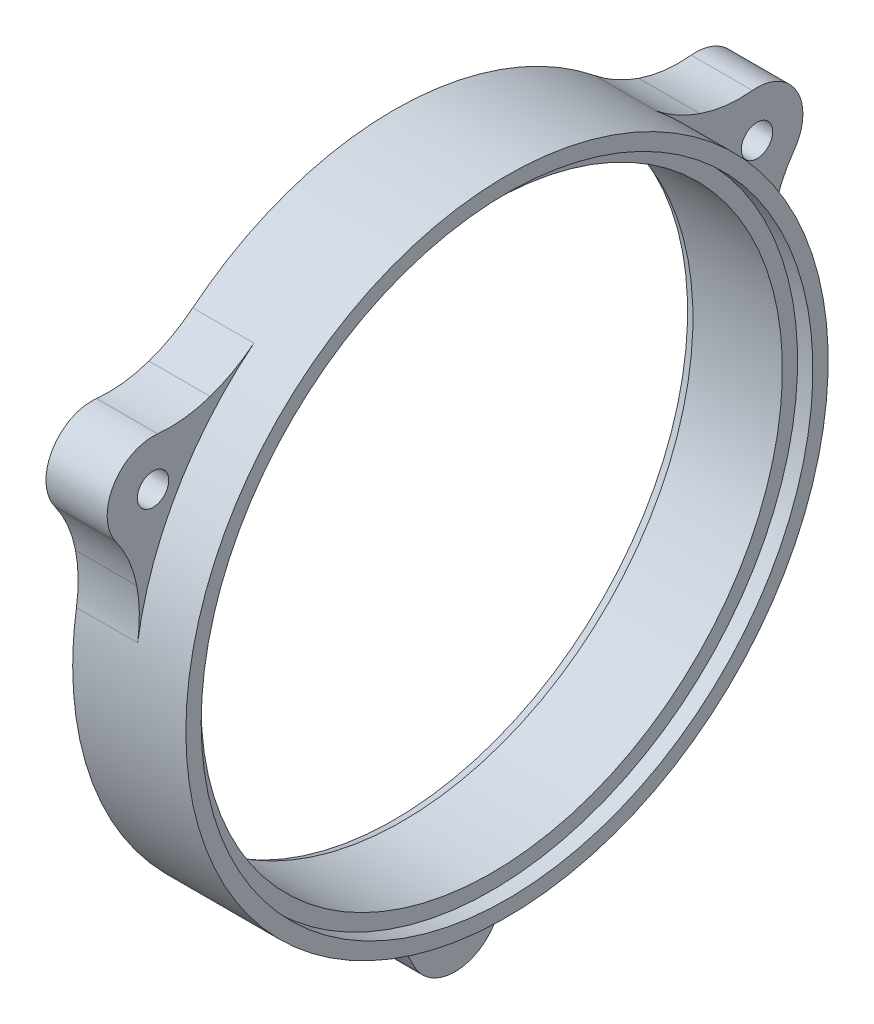
from build123d import *

# Parameters (mm, degrees)
BOSS_EXTRUDE1_START     = -12.7
BOSS_EXTRUDE1_DEPTH     = 12.7
F_1_4_CLEARANCE_HOLE1_D = 6.5278
CIRPATTERN1_COUNT       = 3
CHAMFER1_SIZE           = 0.635
CHAMFER1_SIZE2          = 1.744648161


with BuildPart() as part:
    # Sketch1 → Revolve1 (revolve)
    with BuildSketch(Plane.XY, mode=Mode.PRIVATE) as revolve1_sk:
        Polygon((0, 66.675), (23.495, 66.675), (23.495, 63.5), (20.32, 63.5), (20.32, 60.3504), (0, 60.3504), align=None)
    revolve(revolve1_sk.sketch.rotate(Axis((0, 0, 0), (1, 0, 0)), 90), axis=Axis((0, 0, 0), (1, 0, 0)))

    # Sketch5 → Boss-Extrude1 (add)
    with BuildSketch(Plane.ZY.offset(BOSS_EXTRUDE1_START)):
        with BuildLine():
            ThreePointArc((-61.733643772, 45.671707505), (-70.940470951, 40.9575), (-70.41968082, 30.627050022))
            ThreePointArc((-70.41968082, 30.627050022), (-67.700076965, 25.827577718), (-66.080812198, 20.554138506))
            ThreePointArc((-66.080812198, 20.554138506), (-65.542300069, 15.371802621), (-65.894280688, 10.17346537))
            ThreePointArc((-65.894280688, 10.17346537), (-57.742243797, 33.3375), (-41.757619799, 51.979388355))
            ThreePointArc((-41.757619799, 51.979388355), (-46.083521606, 49.075395572), (-50.840812198, 46.950592813))
            ThreePointArc((-50.840812198, 46.950592813), (-56.217376905, 45.716197631), (-61.733643772, 45.671707505))
        make_face()
    boss_extrude1 = extrude(amount=BOSS_EXTRUDE1_DEPTH)

    # 1/4 Clearance Hole1 (through all)
    with Locations(Plane.ZY):
        with Locations((-62.69157898, 36.195)):
            f_1_4_clearance_hole1 = Hole(F_1_4_CLEARANCE_HOLE1_D / 2)

    # CirPattern1: Boss-Extrude1, 1/4 Clearance Hole1 ×3 about axis
    cirpattern1_axis = Axis((0, 0, 0), (1, 0, 0))
    add([boss_extrude1.rotate(cirpattern1_axis, i * 360 / CIRPATTERN1_COUNT) for i in range(1, CIRPATTERN1_COUNT)])
    add([f_1_4_clearance_hole1.rotate(cirpattern1_axis, i * 360 / CIRPATTERN1_COUNT) for i in range(1, CIRPATTERN1_COUNT)], mode=Mode.SUBTRACT)

    # Chamfer1
    chamfer1_edges = [part.edges().sort_by_distance(p)[0] for p in [
        (0, 0, -60.3504),
    ]]
    chamfer1_side = [part.faces().sort_by_distance(p)[0] for p in [
        (0, -36.487585779, 53.312085734),
    ]]
    chamfer(chamfer1_edges, length=CHAMFER1_SIZE, length2=CHAMFER1_SIZE2, reference=chamfer1_side[0])


solid = part.part
